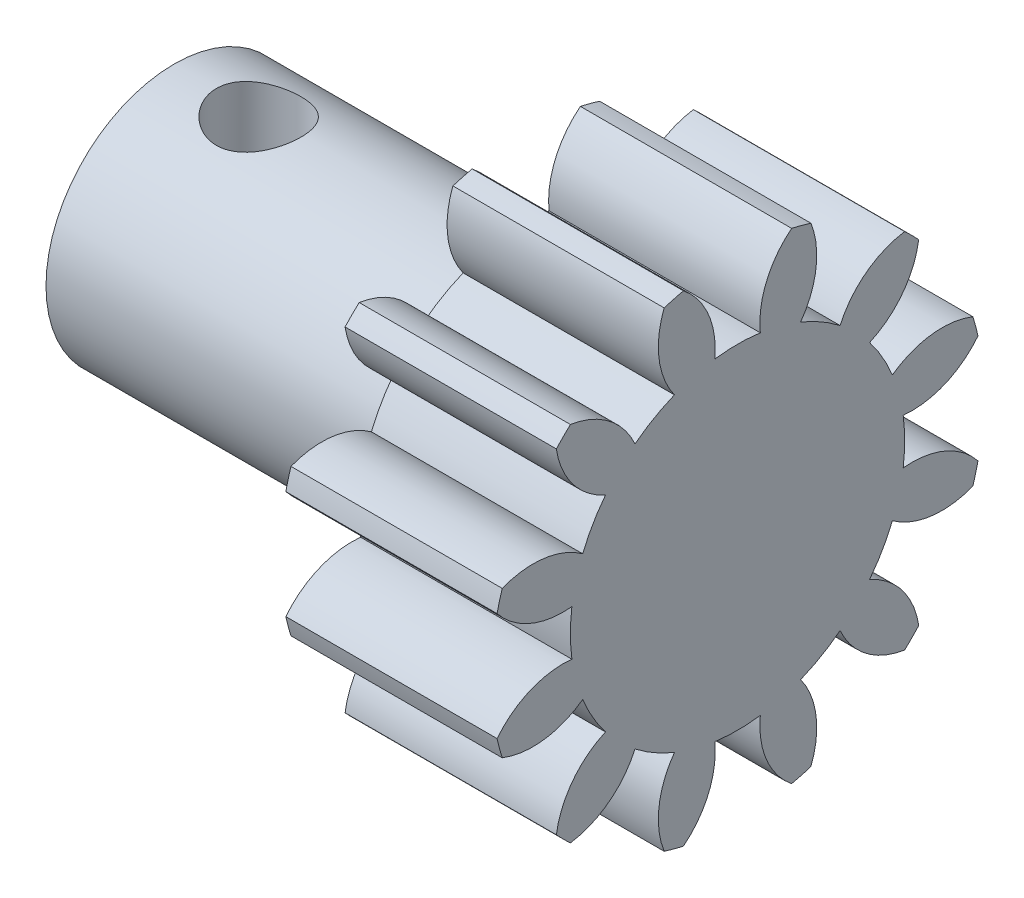
from build123d import *

# Parameters (mm, degrees)
BASPROSKE_W         = 9.525
BASPROSKE_H         = 11.1125
TOOTHCUT_DEPTH      = 19.376641083
TEETHCUTS_COUNT     = 12
BORSKE_R            = 3.175
BORE_DEPTH          = 50.8000508
BOSS_EXTRUDE1_START = -25.4
SKETCH2_R           = 7.539355
BOSS_EXTRUDE1_DEPTH = 25.4
CUT_EXTRUDE1_DEPTH  = 20
SKETCH5_R           = 1.905
CUT_EXTRUDE2_DEPTH  = 24.605363577
SKETCH6_R           = 12.7
SKETCH6_R_2         = 5.7785
CUT_EXTRUDE3_DEPTH  = 15.875


with BuildPart() as part:
    # BasProSke → Base-Revolve (revolve)
    with BuildSketch(Plane(origin=(0, 0, 0), x_dir=(1, 0, 0), z_dir=(0, 1, 0)), mode=Mode.PRIVATE) as base_revolve_sk:
        with Locations((4.7625, 5.55625)):
            Rectangle(BASPROSKE_W, BASPROSKE_H)
    revolve(base_revolve_sk.sketch.rotate(Axis((-10, 0, 0), (1, 0, 0)), 180), axis=Axis((-10, 0, 0), (1, 0, 0)))

    # TooCutSke → ToothCut (cut, through all)
    with BuildSketch(Plane(origin=(0, 0, 0), x_dir=(0, 0, -1), z_dir=(1, 0, 0))):
        with BuildLine():
            ThreePointArc((1.026937745, 7.469087808), (0, 7.539355), (-1.026937745, 7.469087808))
            ThreePointArc((-1.026937745, 7.469087808), (-1.30857978, 9.35080814), (-2.465050847, 10.861691431))
            ThreePointArc((-2.465050847, 10.861691431), (0, 11.1379), (2.465050847, 10.861691431))
            ThreePointArc((2.465050847, 10.861691431), (1.30857978, 9.35080814), (1.026937745, 7.469087808))
        make_face()
    toothcut = extrude(amount=TOOTHCUT_DEPTH, mode=Mode.SUBTRACT)

    # TeethCuts: ToothCut ×12 about axis
    teethcuts_axis = Axis((0, 0, 0), (1, 0, 0))
    for i in range(1, TEETHCUTS_COUNT):
        add(toothcut.rotate(teethcuts_axis, i * 360 / TEETHCUTS_COUNT), mode=Mode.SUBTRACT)

    # BorSke → Bore (cut, symmetric)
    with BuildSketch(Plane(origin=(0, 0, 0), x_dir=(0, 0, -1), z_dir=(1, 0, 0))):
        with Locations(Location((0, 0, 0), (0, 0, 180))):
            Circle(BORSKE_R)
    extrude(amount=BORE_DEPTH, both=True, mode=Mode.SUBTRACT)

    # Sketch2 → Boss-Extrude1 (add)
    with BuildSketch(Plane(origin=(9.525, 0, 0), x_dir=(0, 0, -1), z_dir=(1, 0, 0)).offset(BOSS_EXTRUDE1_START)):
        with Locations(Location((0, 0, 0), (0, 0, 172.171388978))):
            Circle(SKETCH2_R)
    extrude(amount=BOSS_EXTRUDE1_DEPTH)

    # Sketch3 → Cut-Extrude1 (cut)
    with BuildSketch(Plane.ZY.offset(15.875)):
        with BuildLine():
            Line((-1.778, 2.8575), (1.778, 2.8575))
            ThreePointArc((1.778, 2.8575), (0, -3.3655), (-1.778, 2.8575))
        make_face()
    extrude(amount=-CUT_EXTRUDE1_DEPTH, mode=Mode.SUBTRACT)

    # Sketch5 → Cut-Extrude2 (cut, through all)
    with BuildSketch(Plane.XZ.offset(-2.8575)):
        with Locations(Location((-12.065, 0, 0), (0, 0, 270))):
            Circle(SKETCH5_R)
    extrude(amount=-CUT_EXTRUDE2_DEPTH, mode=Mode.SUBTRACT)

    # Sketch6 → Cut-Extrude3 (cut)
    with BuildSketch(Plane.ZY.offset(15.875)):
        Circle(SKETCH6_R)
        Circle(SKETCH6_R_2, mode=Mode.SUBTRACT)
    extrude(amount=-CUT_EXTRUDE3_DEPTH, mode=Mode.SUBTRACT)


solid = part.part
